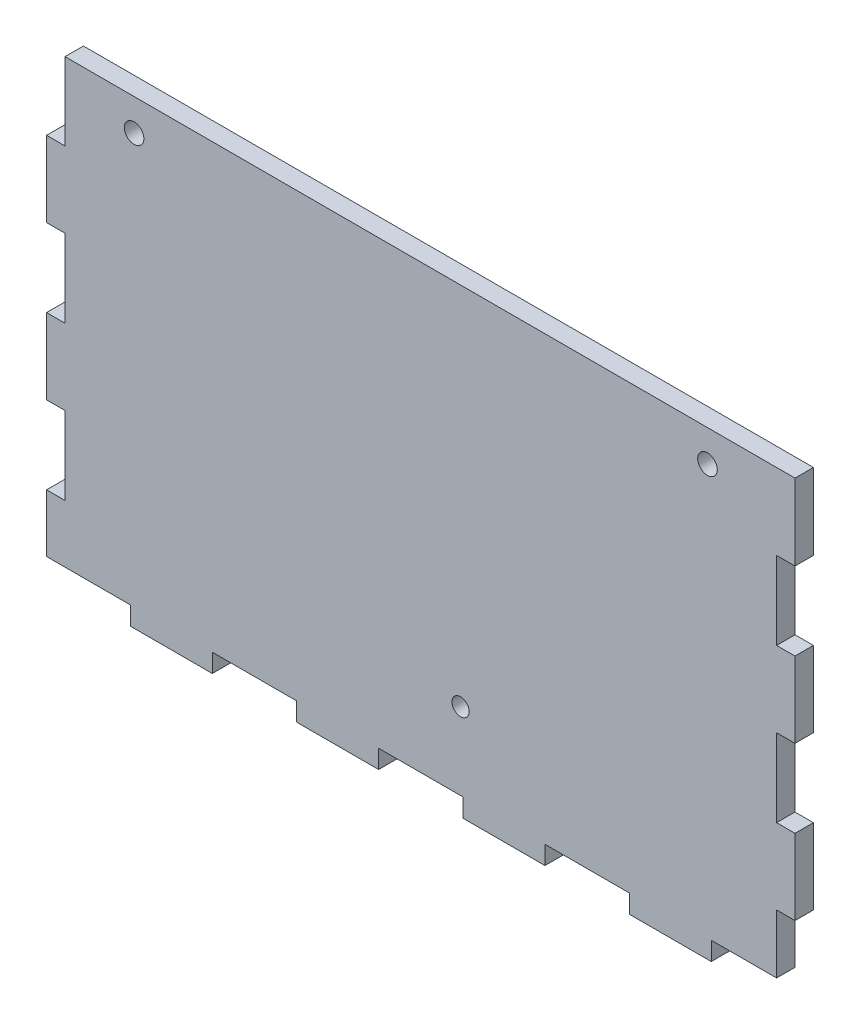
from build123d import *

# Parameters (mm, degrees)
SKETCH1_W           = 130
SKETCH1_H           = 80
BOSS_EXTRUDE1_DEPTH = 3.2
SKETCH2_W           = 14.444444444
SKETCH2_H           = 3.2
SKETCH2_W_2         = 3.2
SKETCH2_H_2         = 13.333333334
SKETCH2_H_3         = 13.333333333
CUT_EXTRUDE1_DEPTH  = 153.676913775
MOVE_FACE1_BY       = 0.1
MOVE_FACE1_2_BY     = 0.1
MOVE_FACE1_3_BY     = 0.1
MOVE_FACE1_4_BY     = 0.1
MOVE_FACE1_5_BY     = 0.1
MOVE_FACE1_6_BY     = 0.1
MOVE_FACE1_7_BY     = 0.1
MOVE_FACE1_8_BY     = 0.1
MOVE_FACE1_9_BY     = 0.1
MOVE_FACE1_10_BY    = 0.1
MOVE_FACE1_11_BY    = 0.1
MOVE_FACE1_12_BY    = 0.1
MOVE_FACE1_13_BY    = 0.1
MOVE_FACE1_14_BY    = 0.1
MOVE_FACE1_15_BY    = 0.1
MOVE_FACE1_16_BY    = 0.1
MOVE_FACE1_17_BY    = 0.1
MOVE_FACE1_18_BY    = 0.1
CUT_EXTRUDE2_REACH  = 154.677
SKETCH3_R           = 1.7
CUT_EXTRUDE3_REACH  = 154.677
SKETCH4_R           = 1.5


with BuildPart() as part:
    # Sketch1 → Boss-Extrude1 (new body)
    with BuildSketch(Plane.XY):
        with Locations((65, 40)):
            Rectangle(SKETCH1_W, SKETCH1_H)
    extrude(amount=BOSS_EXTRUDE1_DEPTH)

    # Sketch2 → Cut-Extrude1 (cut, through all)
    with BuildSketch(Plane.XY.offset(3.2)):
        with Locations((7.222222222, 1.6)):
            Rectangle(SKETCH2_W, SKETCH2_H)
        with Locations((36.111111111, 1.6)):
            Rectangle(SKETCH2_W, SKETCH2_H)
        with Locations((65, 1.6)):
            Rectangle(SKETCH2_W, SKETCH2_H)
        with Locations((93.888888889, 1.6)):
            Rectangle(SKETCH2_W, SKETCH2_H)
        Polygon((115.555555556, 0), (115.555555556, 3.2), (126.8, 3.2), (126.8, 13.333333333), (130, 13.333333333), (130, 0), align=None)
        with Locations((1.6, 20)):
            Rectangle(SKETCH2_W_2, SKETCH2_H_2)
        with Locations((1.6, 46.666666667)):
            Rectangle(SKETCH2_W_2, SKETCH2_H_3)
        with Locations((1.6, 73.333333334)):
            Rectangle(SKETCH2_W_2, SKETCH2_H_3)
        with Locations((128.4, 33.333333334)):
            Rectangle(SKETCH2_W_2, SKETCH2_H_3)
        with Locations((128.4, 60)):
            Rectangle(SKETCH2_W_2, SKETCH2_H_2)
    extrude(amount=-CUT_EXTRUDE1_DEPTH, mode=Mode.SUBTRACT)

    # Move Face1: a face moved inward by 0.1
    extrude(part.faces().sort_by_distance((128.4, 53.333333333, 1.6))[0], amount=MOVE_FACE1_BY, dir=(0, -1, 0), mode=Mode.SUBTRACT)

    # Move Face1 2: a face moved inward by 0.1
    extrude(part.faces().sort_by_distance((128.4, 26.666666667, 1.6))[0], amount=MOVE_FACE1_2_BY, dir=(0, -1, 0), mode=Mode.SUBTRACT)

    # Move Face1 3: a face moved inward by 0.1
    extrude(part.faces().sort_by_distance((128.4, 13.333333333, 1.6))[0], amount=MOVE_FACE1_3_BY, dir=(0, 1, 0), mode=Mode.SUBTRACT)

    # Move Face1 4: a face moved inward by 0.1
    extrude(part.faces().sort_by_distance((128.4, 40, 1.6))[0], amount=MOVE_FACE1_4_BY, dir=(0, 1, 0), mode=Mode.SUBTRACT)

    # Move Face1 5: a face moved inward by 0.1
    extrude(part.faces().sort_by_distance((128.4, 66.666666667, 1.6))[0], amount=MOVE_FACE1_5_BY, dir=(0, 1, 0), mode=Mode.SUBTRACT)

    # Move Face1 6: a face moved inward by 0.1
    extrude(part.faces().sort_by_distance((115.555555556, 1.6, 1.6))[0], amount=MOVE_FACE1_6_BY, dir=(-1, 0, 0), mode=Mode.SUBTRACT)

    # Move Face1 7: a face moved inward by 0.1
    extrude(part.faces().sort_by_distance((86.666666667, 1.6, 1.6))[0], amount=MOVE_FACE1_7_BY, dir=(-1, 0, 0), mode=Mode.SUBTRACT)

    # Move Face1 8: a face moved inward by 0.1
    extrude(part.faces().sort_by_distance((57.777777778, 1.6, 1.6))[0], amount=MOVE_FACE1_8_BY, dir=(-1, 0, 0), mode=Mode.SUBTRACT)

    # Move Face1 9: a face moved inward by 0.1
    extrude(part.faces().sort_by_distance((28.888888889, 1.6, 1.6))[0], amount=MOVE_FACE1_9_BY, dir=(-1, 0, 0), mode=Mode.SUBTRACT)

    # Move Face1 10: a face moved inward by 0.1
    extrude(part.faces().sort_by_distance((14.444444444, 1.6, 1.6))[0], amount=MOVE_FACE1_10_BY, dir=(1, 0, 0), mode=Mode.SUBTRACT)

    # Move Face1 11: a face moved inward by 0.1
    extrude(part.faces().sort_by_distance((43.333333333, 1.6, 1.6))[0], amount=MOVE_FACE1_11_BY, dir=(1, 0, 0), mode=Mode.SUBTRACT)

    # Move Face1 12: a face moved inward by 0.1
    extrude(part.faces().sort_by_distance((72.222222222, 1.6, 1.6))[0], amount=MOVE_FACE1_12_BY, dir=(1, 0, 0), mode=Mode.SUBTRACT)

    # Move Face1 13: a face moved inward by 0.1
    extrude(part.faces().sort_by_distance((101.111111111, 1.6, 1.6))[0], amount=MOVE_FACE1_13_BY, dir=(1, 0, 0), mode=Mode.SUBTRACT)

    # Move Face1 14: a face moved inward by 0.1
    extrude(part.faces().sort_by_distance((1.6, 26.666666667, 1.6))[0], amount=MOVE_FACE1_14_BY, dir=(0, 1, 0), mode=Mode.SUBTRACT)

    # Move Face1 15: a face moved inward by 0.1
    extrude(part.faces().sort_by_distance((1.6, 13.333333333, 1.6))[0], amount=MOVE_FACE1_15_BY, dir=(0, -1, 0), mode=Mode.SUBTRACT)

    # Move Face1 16: a face moved inward by 0.1
    extrude(part.faces().sort_by_distance((1.6, 40, 1.6))[0], amount=MOVE_FACE1_16_BY, dir=(0, -1, 0), mode=Mode.SUBTRACT)

    # Move Face1 17: a face moved inward by 0.1
    extrude(part.faces().sort_by_distance((1.6, 53.333333333, 1.6))[0], amount=MOVE_FACE1_17_BY, dir=(0, 1, 0), mode=Mode.SUBTRACT)

    # Move Face1 18: a face moved inward by 0.1
    extrude(part.faces().sort_by_distance((1.6, 66.666666667, 1.6))[0], amount=MOVE_FACE1_18_BY, dir=(0, -1, 0), mode=Mode.SUBTRACT)

    # Sketch3 → Cut-Extrude2 (cut, up to next)
    with BuildSketch(Plane.XY.offset(3.2), mode=Mode.PRIVATE) as cut_extrude2_sk1:
        with Locations((15.2, 74.5)):
            Circle(SKETCH3_R)
    cut_extrude2_tool1 = extrude(cut_extrude2_sk1.sketch, amount=-CUT_EXTRUDE2_REACH, mode=Mode.PRIVATE) & part.part
    # Sketch3 → Cut-Extrude2 (cut, up to next)
    with BuildSketch(Plane.XY.offset(3.2), mode=Mode.PRIVATE) as cut_extrude2_sk2:
        with Locations(Location((114.8, 74.5, 0), (0, 0, 180))):
            Circle(SKETCH3_R)
    cut_extrude2_tool2 = extrude(cut_extrude2_sk2.sketch, amount=-CUT_EXTRUDE2_REACH, mode=Mode.PRIVATE) & part.part
    add(cut_extrude2_tool1.solids().sort_by_distance((15.2, 74.5, 3.2))[0], mode=Mode.SUBTRACT)
    add(cut_extrude2_tool2.solids().sort_by_distance((114.8, 74.5, 3.2))[0], mode=Mode.SUBTRACT)

    # Sketch4 → Cut-Extrude3 (cut, up to next)
    with BuildSketch(Plane(origin=(0, 0, 0), x_dir=(-1, 0, 0), z_dir=(0, 0, -1)), mode=Mode.PRIVATE) as cut_extrude3_sk1:
        with Locations((-71.91, 16.56)):
            Circle(SKETCH4_R)
    cut_extrude3_tool1 = extrude(cut_extrude3_sk1.sketch, amount=-CUT_EXTRUDE3_REACH, mode=Mode.PRIVATE) & part.part
    add(cut_extrude3_tool1.solids().sort_by_distance((71.91, 16.56, 0))[0], mode=Mode.SUBTRACT)


solid = part.part
